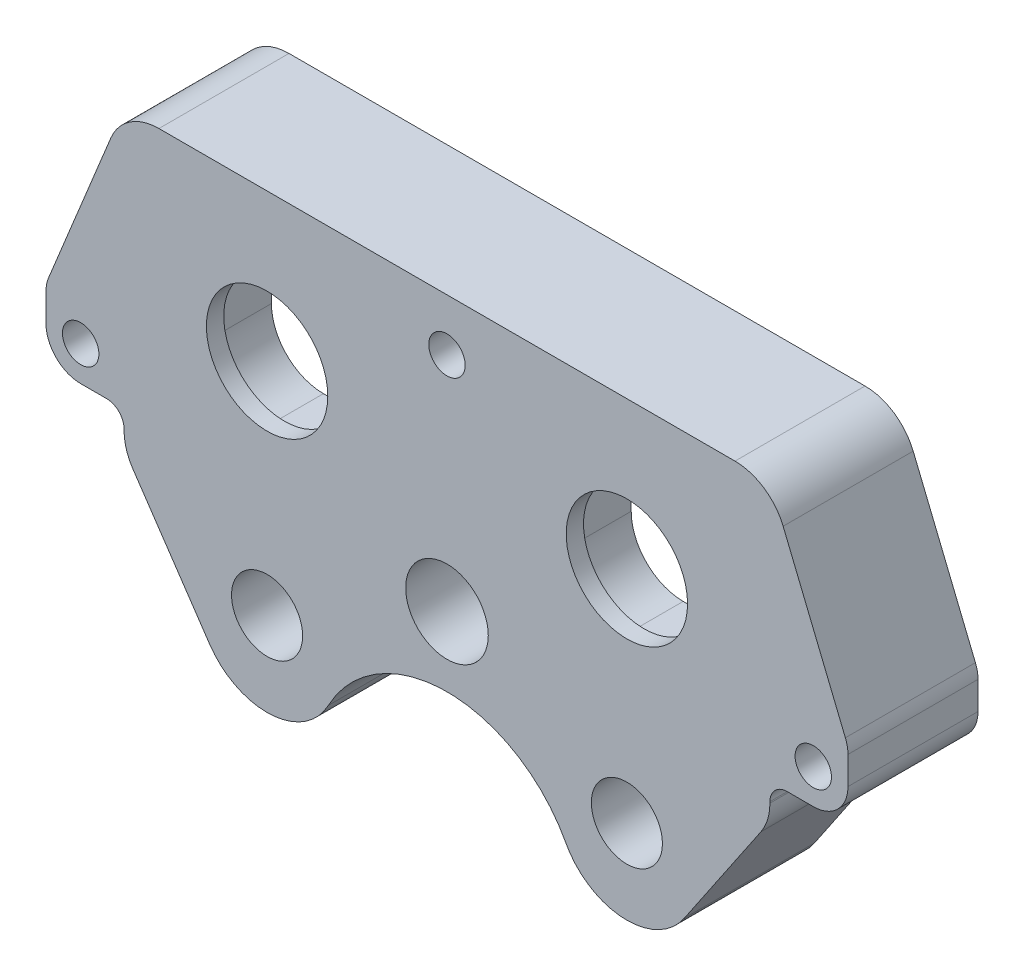
from build123d import *

# Parameters (mm, degrees)
SKETCH5_R           = 7
SKETCH5_R_2         = 4.7625
SKETCH5_R_3         = 2.1
SKETCH5_R_4         = 4.1
BOSS_EXTRUDE5_DEPTH = 15
CUT_EXTRUDE1_START  = -2
SKETCH1_W           = 29
SKETCH1_H           = 30
SKETCH1_R           = 7
CUT_EXTRUDE1_DEPTH  = 13
CUT_EXTRUDE2_START  = -13
SKETCH5_3_R         = 6.75
SKETCH5_3_R_2       = 4.1
CUT_EXTRUDE2_DEPTH  = 2
FILLET1_R           = 6
FILLET2_R           = 4
FILLET3_R           = 6
FILLET4_R           = 2
BOSS_EXTRUDE6_START = -12.7
SKETCH5_4_R         = 4.7625
BOSS_EXTRUDE6_DEPTH = 2.3


with BuildPart() as part:
    # Sketch5 → Boss-Extrude5 (new body)
    with BuildSketch(Plane.XY):
        with BuildLine():
            Line((58, 17), (-16.5, 17))
            Line((-16.5, 17), (-25.5, -5))
            Line((-25.5, -5), (-25.5, -13))
            Line((-25.5, -13), (-16.5, -13))
            Line((-16.5, -13), (-16.5, -17))
            Line((-16.5, -17), (-6.624344746, -31.585315674))
            ThreePointArc((-6.624344746, -31.585315674), (0.420970348, -35.08891632), (7.059051341, -30.864278705))
            ThreePointArc((7.059051341, -30.864278705), (20.750000185, -22.649146733), (34.440948834, -30.864279032))
            ThreePointArc((34.440948834, -30.864279032), (41.079029838, -35.08891633), (48.124344746, -31.585315674))
            Line((48.124344746, -31.585315674), (58, -17))
            Line((58, -17), (58, -13))
            Line((58, -13), (67, -13))
            Line((67, -13), (67, -5))
            Line((67, -5), (58, 17))
        make_face()
        Circle(SKETCH5_R, mode=Mode.SUBTRACT)
        with Locations((20.75, -14.649146733)):
            Circle(SKETCH5_R_2, mode=Mode.SUBTRACT)
        with Locations((41.5, 0)):
            Circle(SKETCH5_R, mode=Mode.SUBTRACT)
        with Locations((20.75, 11)):
            Circle(SKETCH5_R_3, mode=Mode.SUBTRACT)
        with Locations((-21.5, -9)):
            Circle(SKETCH5_R_3, mode=Mode.SUBTRACT)
        with Locations((63, -9)):
            Circle(SKETCH5_R_3, mode=Mode.SUBTRACT)
        with Locations((41.5, -25.4)):
            Circle(SKETCH5_R_4, mode=Mode.SUBTRACT)
        with Locations((0, -25.4)):
            Circle(SKETCH5_R_4, mode=Mode.SUBTRACT)
    extrude(amount=-BOSS_EXTRUDE5_DEPTH)

    # Sketch1 → Cut-Extrude1 (cut)
    # profile 1 of 2: a face of its own
    with BuildSketch(Plane.XY.offset(CUT_EXTRUDE1_START)):
        Rectangle(SKETCH1_W, SKETCH1_H)
        Circle(SKETCH1_R, mode=Mode.SUBTRACT)
    # profile 2 of 2: a face of its own
    with BuildSketch(Plane.XY.offset(CUT_EXTRUDE1_START)):
        with Locations((41.5, 0)):
            Rectangle(SKETCH1_W, SKETCH1_H)
        with Locations((41.5, 0)):
            Circle(SKETCH1_R, mode=Mode.SUBTRACT)
    extrude(amount=-CUT_EXTRUDE1_DEPTH, mode=Mode.SUBTRACT)

    # Sketch5<3> → Cut-Extrude2 (cut)
    # profile 1 of 2: a face of its own
    with BuildSketch(Plane.XY.offset(CUT_EXTRUDE2_START)):
        with Locations((41.5, -27.1)):
            Circle(SKETCH5_3_R)
        with Locations((41.5, -25.4)):
            Circle(SKETCH5_3_R_2, mode=Mode.SUBTRACT)
    # profile 2 of 2: a face of its own
    with BuildSketch(Plane.XY.offset(CUT_EXTRUDE2_START)):
        with Locations((0, -27.1)):
            Circle(SKETCH5_3_R)
        with Locations((0, -25.4)):
            Circle(SKETCH5_3_R_2, mode=Mode.SUBTRACT)
    extrude(amount=-CUT_EXTRUDE2_DEPTH, mode=Mode.SUBTRACT)

    # Fillet1
    fillet1_edges = [part.edges().sort_by_distance(p)[0] for p in [
        (-14.5, -15, -8.5),
        (14.5, -15, -8.5),
        (14.5, 15, -8.5),
        (-14.5, 15, -8.5),
        (27, -15, -8.5),
        (56, -15, -8.5),
        (56, 15, -8.5),
        (27, 15, -8.5),
    ]]
    fillet(fillet1_edges, radius=FILLET1_R)

    # Fillet2
    fillet2_edges = [part.edges().sort_by_distance(p)[0] for p in [
        (67, -13, -7.5),
        (-25.5, -13, -7.5),
        (-25.5, -5, -7.5),
        (67, -5, -7.5),
    ]]
    fillet(fillet2_edges, radius=FILLET2_R)

    # Fillet3
    fillet3_edges = [part.edges().sort_by_distance(p)[0] for p in [
        (58, -17, -7.5),
        (-16.5, -17, -7.5),
        (-16.5, 17, -7.5),
        (58, 17, -7.5),
    ]]
    fillet(fillet3_edges, radius=FILLET3_R)

    # Fillet4
    fillet4_edges = [part.edges().sort_by_distance(p)[0] for p in [
        (58, -13, -7.5),
        (-16.5, -13, -7.5),
    ]]
    fillet(fillet4_edges, radius=FILLET4_R)

    # Sketch5<4> → Boss-Extrude6 (add)
    with BuildSketch(Plane.XY.offset(BOSS_EXTRUDE6_START)):
        with Locations((20.75, -14.649146733)):
            Circle(SKETCH5_4_R)
    extrude(amount=-BOSS_EXTRUDE6_DEPTH)


solid = part.part
